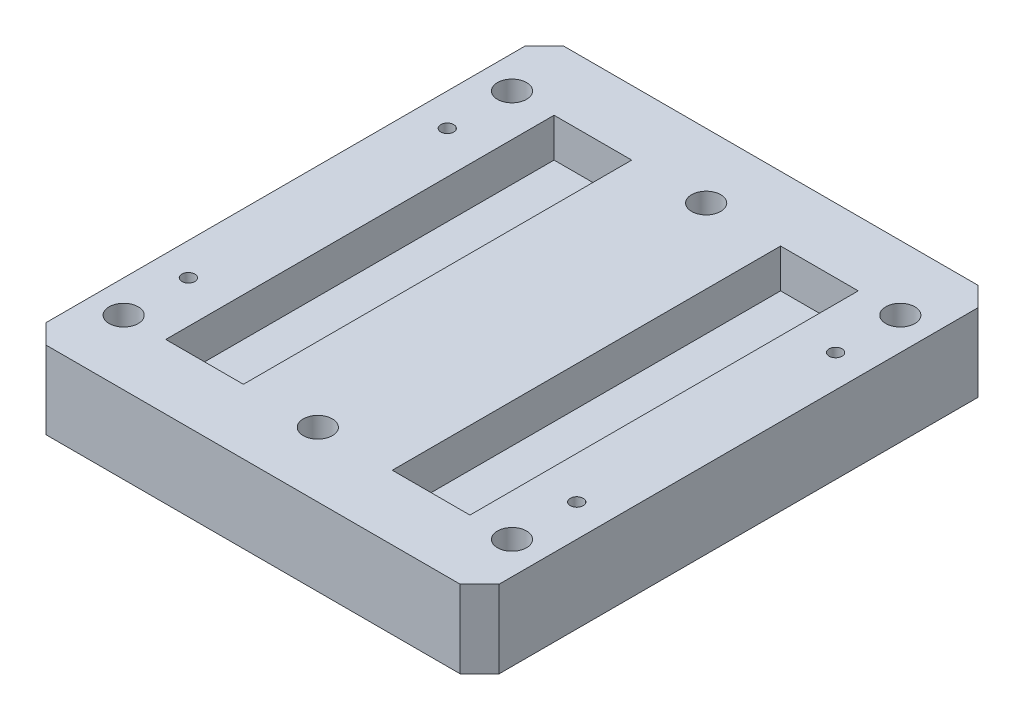
from build123d import *

# Parameters (mm, degrees)
ESQUISSE1_W             = 70
ESQUISSE1_H             = 12
BOSS_EXTRU_1_DEPTH      = 80
ESQUISSE2_W             = 12
ESQUISSE2_H             = 6
ENL_V_MAT_EXTRU_1_DEPTH = 107.976632963
ESQUISSE4_R             = 2.25
ENL_V_MAT_EXTRU_3_DEPTH = 107.976632963
ESQUISSE5_W             = 12
ESQUISSE5_H             = 10
BOSS_EXTRU_2_DEPTH      = 6
CHANFREIN1_SIZE         = 3
ESQUISSE6_R             = 1
ENL_V_MAT_EXTRU_4_DEPTH = 12


with BuildPart() as part:
    # Esquisse1 → Boss.-Extru.1 (new body)
    with BuildSketch(Plane.XY):
        with Locations((35, 6)):
            Rectangle(ESQUISSE1_W, ESQUISSE1_H)
    extrude(amount=BOSS_EXTRU_1_DEPTH)

    # Esquisse2 → Enlèv. mat.-Extru.1 (cut, through all)
    with BuildSketch(Plane.XY.offset(80)):
        with Locations((52.5, 9)):
            Rectangle(ESQUISSE2_W, ESQUISSE2_H)
        with Locations((17.5, 9)):
            Rectangle(ESQUISSE2_W, ESQUISSE2_H)
    extrude(amount=-ENL_V_MAT_EXTRU_1_DEPTH, mode=Mode.SUBTRACT)

    # Esquisse4 → Enlèv. mat.-Extru.3 (cut, through all)
    with BuildSketch(Plane(origin=(0, 12, 0), x_dir=(1, 0, 0), z_dir=(0, 1, 0))):
        with Locations(Location((5, -10, 0), (0, 0, 270))):
            Circle(ESQUISSE4_R)
        with Locations(Location((65, -70, 0), (0, 0, 270))):
            Circle(ESQUISSE4_R)
        with Locations(Location((65, -10, 0), (0, 0, 90))):
            Circle(ESQUISSE4_R)
        with Locations(Location((5, -70, 0), (0, 0, 90))):
            Circle(ESQUISSE4_R)
        with Locations(Location((35, -10, 0), (0, 0, 270))):
            Circle(ESQUISSE4_R)
        with Locations(Location((35, -70, 0), (0, 0, 270))):
            Circle(ESQUISSE4_R)
    extrude(amount=-ENL_V_MAT_EXTRU_3_DEPTH, mode=Mode.SUBTRACT)

    # Esquisse5 → Boss.-Extru.2 (add)
    with BuildSketch(Plane(origin=(0, 12, 0), x_dir=(1, 0, 0), z_dir=(0, 1, 0))):
        with Locations((17.5, -75)):
            Rectangle(ESQUISSE5_W, ESQUISSE5_H)
        with Locations((52.5, -75)):
            Rectangle(ESQUISSE5_W, ESQUISSE5_H)
        with Locations((52.5, -5)):
            Rectangle(ESQUISSE5_W, ESQUISSE5_H)
        with Locations((17.5, -5)):
            Rectangle(ESQUISSE5_W, ESQUISSE5_H)
    extrude(amount=-BOSS_EXTRU_2_DEPTH)

    # Chanfrein1
    chanfrein1_edges = [part.edges().sort_by_distance(p)[0] for p in [
        (70, 6, 80),
        (0, 6, 80),
        (70, 6, 0),
        (0, 6, 0),
    ]]
    chamfer(chanfrein1_edges, length=CHANFREIN1_SIZE)

    # Esquisse6 → Enlèv. mat.-Extru.4 (cut)
    with BuildSketch(Plane(origin=(0, 12, 0), x_dir=(1, 0, 0), z_dir=(0, 1, 0))):
        with Locations(Location((5, -20, 0), (0, 0, 270))):
            Circle(ESQUISSE6_R)
        with Locations(Location((5, -60, 0), (0, 0, 90))):
            Circle(ESQUISSE6_R)
        with Locations(Location((65, -60, 0), (0, 0, 270))):
            Circle(ESQUISSE6_R)
        with Locations(Location((65, -20, 0), (0, 0, 90))):
            Circle(ESQUISSE6_R)
    extrude(amount=-ENL_V_MAT_EXTRU_4_DEPTH, mode=Mode.SUBTRACT)


solid = part.part
